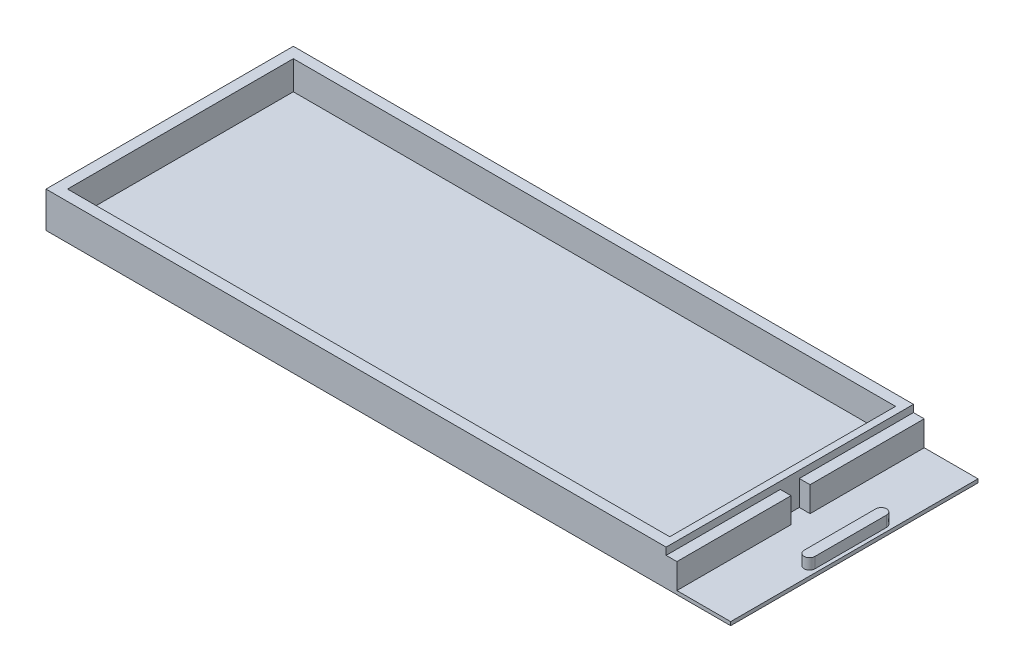
from build123d import *

# Parameters (mm, degrees)
SKETCH1_W                      = 168
SKETCH1_H                      = 63
BOSS_EXTRUDE1_DEPTH            = 10
SKETCH2_W                      = 168
SKETCH2_H                      = 63
BOSS_EXTRUDE2_DEPTH            = 2
SKETCH3_W                      = 10
SKETCH3_H                      = 25
CUT_EXTRUDE1_DEPTH             = 111.028405423
SKETCH4_W                      = 10
SKETCH4_H                      = 8
CUT_EXTRUDE2_DEPTH             = 3
CUT_EXTRUDE2_DIRECTION_2_REACH = 114.236
SKETCH6_W                      = 10
SKETCH6_H                      = 1
BOSS_EXTRUDE4_DEPTH            = 31
SKETCH7_R                      = 1.5
BOSS_EXTRUDE5_DEPTH            = 3
SKETCH8_W                      = 10
SKETCH8_H                      = 5
BOSS_EXTRUDE6_DEPTH            = 3
SKETCH9_W                      = 15
SKETCH9_H                      = 10
CUT_EXTRUDE3_DEPTH             = 126.207827231
SKETCH10_W                     = 69
SKETCH10_H                     = 1
BOSS_EXTRUDE7_DEPTH            = 15
SKETCH12_W                     = 3
SKETCH12_H                     = 2
CUT_EXTRUDE5_DEPTH             = 126.207827231
SKETCH13_W                     = 5.3
SKETCH13_H                     = 7
CUT_EXTRUDE6_DEPTH             = 3
BOSS_EXTRUDE8_DEPTH            = 3


with BuildPart() as part:
    # Sketch1 → Boss-Extrude1 (new body)
    with BuildSketch(Plane(origin=(0, 0, 0), x_dir=(1, 0, 0), z_dir=(0, 1, 0))):
        Polygon((0, 34.5), (-87, 34.5), (-87, -34.5), (84, -34.5), (104, -34.5), (104, 34.5), (84, 34.5), align=None)
        Rectangle(SKETCH1_W, SKETCH1_H, mode=Mode.SUBTRACT)
    extrude(amount=BOSS_EXTRUDE1_DEPTH)

    # Sketch2 → Boss-Extrude2 (add)
    with BuildSketch(Plane(origin=(0, 0, 0), x_dir=(1, 0, 0), z_dir=(0, 1, 0))):
        Rectangle(SKETCH2_W, SKETCH2_H)
    extrude(amount=BOSS_EXTRUDE2_DEPTH)

    # Sketch3 → Cut-Extrude1 (cut, through all)
    with BuildSketch(Plane(origin=(0, 10, 0), x_dir=(1, 0, 0), z_dir=(0, 1, 0))):
        with Locations((94, 19)):
            Rectangle(SKETCH3_W, SKETCH3_H)
    cut_extrude1 = extrude(amount=-CUT_EXTRUDE1_DEPTH, mode=Mode.SUBTRACT)

    # Mirror1: Cut-Extrude1 across plane
    add(cut_extrude1.mirror(Plane.XY), mode=Mode.SUBTRACT)

    # Sketch4 → Cut-Extrude2 (cut)
    with BuildSketch(Plane.XY.offset(6.5)):
        with Locations((94, 4)):
            Rectangle(SKETCH4_W, SKETCH4_H)
    cut_extrude2 = extrude(amount=-CUT_EXTRUDE2_DEPTH, mode=Mode.SUBTRACT)

    # Sketch4 → Cut-Extrude2 direction 2 (cut, up to next)
    with BuildSketch(Plane.XY.offset(6.5), mode=Mode.PRIVATE) as cut_extrude2_direction_2_sk1:
        with Locations((94, 4)):
            Rectangle(SKETCH4_W, SKETCH4_H)
    cut_extrude2_direction_2_tool1 = extrude(cut_extrude2_direction_2_sk1.sketch, amount=CUT_EXTRUDE2_DIRECTION_2_REACH, mode=Mode.PRIVATE) & part.part
    cut_extrude2_direction_2 = cut_extrude2_direction_2_tool1.solids().sort_by_distance((94, 4, 6.5))[0]
    add(cut_extrude2_direction_2, mode=Mode.SUBTRACT)

    # Mirror2: Cut-Extrude2, Cut-Extrude2 direction 2 across plane
    add(cut_extrude2.mirror(Plane.XY), mode=Mode.SUBTRACT)
    add(cut_extrude2_direction_2.mirror(Plane.XY), mode=Mode.SUBTRACT)

    # Sketch6 → Boss-Extrude4 (add)
    with BuildSketch(Plane.XY.offset(3.5)):
        with Locations((94, 0.5)):
            Rectangle(SKETCH6_W, SKETCH6_H)
    boss_extrude4 = extrude(amount=BOSS_EXTRUDE4_DEPTH)

    # Mirror5: Boss-Extrude4 across plane
    add(boss_extrude4.mirror(Plane.XY))

    # Sketch7 → Boss-Extrude5 (add)
    with BuildSketch(Plane.XY.offset(3.5)):
        with Locations((94, 4.5)):
            Circle(SKETCH7_R)
    boss_extrude5 = extrude(amount=BOSS_EXTRUDE5_DEPTH)

    # Mirror6: Boss-Extrude5 across plane
    add(boss_extrude5.mirror(Plane.XY))

    # Sketch8 → Boss-Extrude6 (add)
    with BuildSketch(Plane.ZY.offset(87)):
        with Locations((0, 2.5)):
            Rectangle(SKETCH8_W, SKETCH8_H)
    extrude(amount=BOSS_EXTRUDE6_DEPTH)

    # Sketch9 → Cut-Extrude3 (cut, through all)
    with BuildSketch(Plane.XY.offset(34.5)):
        with Locations((96.5, 5)):
            Rectangle(SKETCH9_W, SKETCH9_H)
    extrude(amount=-CUT_EXTRUDE3_DEPTH, mode=Mode.SUBTRACT)

    # Sketch10 → Boss-Extrude7 (add)
    with BuildSketch(Plane(origin=(89, 0, 0), x_dir=(0, 0, -1), z_dir=(1, 0, 0))):
        with Locations((0, 0.5)):
            Rectangle(SKETCH10_W, SKETCH10_H)
    extrude(amount=BOSS_EXTRUDE7_DEPTH)

    # Sketch12 → Cut-Extrude5 (cut, through all)
    with BuildSketch(Plane.XY.offset(34.5)):
        with Locations((87.5, 9)):
            Rectangle(SKETCH12_W, SKETCH12_H)
    extrude(amount=-CUT_EXTRUDE5_DEPTH, mode=Mode.SUBTRACT)

    # Sketch13 → Cut-Extrude6 (cut)
    with BuildSketch(Plane(origin=(89, 0, 0), x_dir=(0, 0, -1), z_dir=(1, 0, 0))):
        with Locations((0, 4.5)):
            Rectangle(SKETCH13_W, SKETCH13_H)
    extrude(amount=-CUT_EXTRUDE6_DEPTH, mode=Mode.SUBTRACT)

    # Sketch15 → Boss-Extrude8 (add)
    with BuildSketch(Plane(origin=(0, 1, 0), x_dir=(1, 0, 0), z_dir=(0, 1, 0))):
        with BuildLine():
            Line((103, 10), (103, -10))
            ThreePointArc((103, -10), (101.5, -11.5), (100, -10))
            Line((100, -10), (100, 10))
            ThreePointArc((100, 10), (101.5, 11.5), (103, 10))
        make_face()
    extrude(amount=BOSS_EXTRUDE8_DEPTH)


solid = part.part
